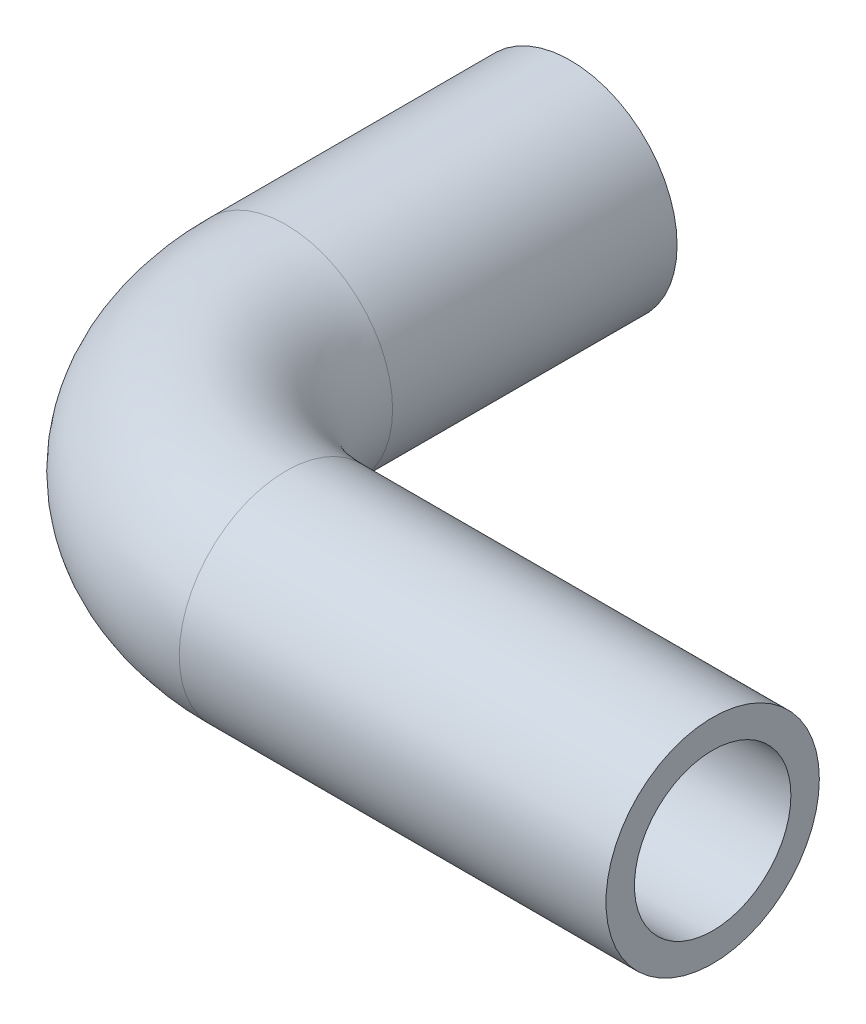
from build123d import *

# Parameters (mm, degrees)
SWEEP1_PROFILE_R   = 37.5
SHELL1_T           = -10
CUT_EXTRUDE1_REACH = 264.797
SKETCH4_R          = 27.5


with BuildPart() as part:
    # Sweep1: sweep along a path in Sketch2
    with BuildLine(Plane(origin=(0, 0, 0), x_dir=(1, 0, 0), z_dir=(0, 1, 0))) as sweep1_path:
        Line((150, 0), (0, 0))
        ThreePointArc((0, 0), (-53.033008589, 21.966991411), (-75, 75))
        Line((-75, 75), (-75, 175))
    # Sweep1 profile (on start of the path) → Sweep1 (sweep)
    with BuildSketch(Plane(origin=(150, 0, 0), x_dir=(0, 0, -1), z_dir=(-1, 0, 0))):
        Circle(SWEEP1_PROFILE_R)
    sweep(path=sweep1_path.line)

    # Shell1
    shell1_openings = [part.faces().sort_by_distance(p)[0] for p in [
        (150, 0, 0),
    ]]
    offset(amount=SHELL1_T, openings=shell1_openings, kind=Kind.INTERSECTION)

    # Sketch4 → Cut-Extrude1 (cut, up to next)
    with BuildSketch(Plane(origin=(0, 0, -175), x_dir=(-1, 0, 0), z_dir=(0, 0, -1)), mode=Mode.PRIVATE) as cut_extrude1_sk1:
        with Locations((75, 0)):
            Circle(SKETCH4_R)
    cut_extrude1_tool1 = extrude(cut_extrude1_sk1.sketch, amount=-CUT_EXTRUDE1_REACH, mode=Mode.PRIVATE) & part.part
    add(cut_extrude1_tool1.solids().sort_by_distance((-75, 0, -175))[0], mode=Mode.SUBTRACT)


solid = part.part
